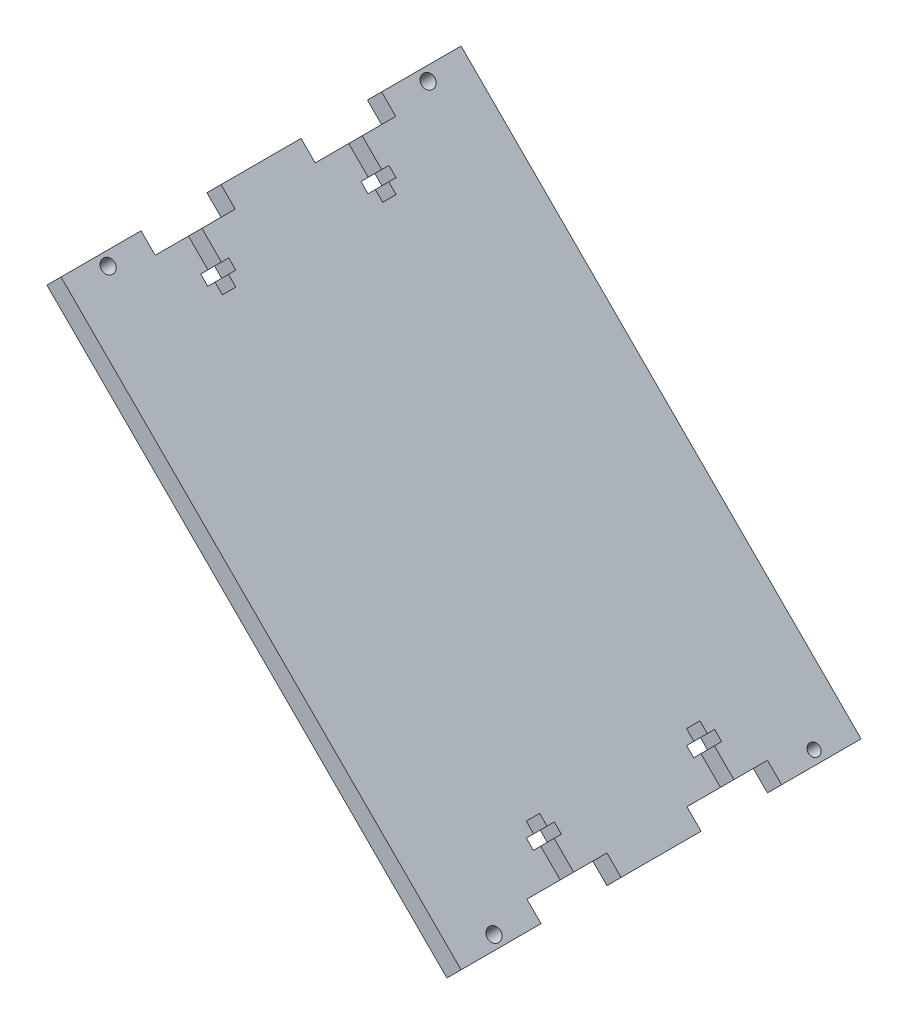
from build123d import *

# Parameters (mm, degrees)
BOSS_EXTRUDE1_DEPTH = 127
SKETCH2_W           = 25.4
SKETCH2_H           = 6.35
SKETCH2_W_2         = 25.559422118
CUT_EXTRUDE1_DEPTH  = 6.35
CUT_EXTRUDE2_DEPTH  = 6.35
SKETCH4_R           = 2.0955
SKETCH4_R_2         = 1.828321723
CUT_EXTRUDE3_DEPTH  = 6.35


with BuildPart() as part:
    # Sketch1 → Boss-Extrude1 (new body)
    with BuildSketch(Plane.XY):
        Polygon((-127, 0), (0, -127), (4.490128061, -122.509871939), (-122.509871939, 4.490128061), align=None)
    extrude(amount=BOSS_EXTRUDE1_DEPTH)

    # Sketch2 → Cut-Extrude1 (cut)
    with BuildSketch(Plane(origin=(-63.5, -63.5, 0), x_dir=(0, 0, 1), z_dir=(-0.7071067811865509, -0.7071067811865441, 0))):
        with Locations((88.9, 86.627561211)):
            Rectangle(SKETCH2_W, SKETCH2_H)
        with Locations((38.020288941, 86.627561211)):
            Rectangle(SKETCH2_W_2, SKETCH2_H)
        with Locations((88.9, -86.627561211)):
            Rectangle(SKETCH2_W, SKETCH2_H)
        with Locations((38.020288941, -86.627561211)):
            Rectangle(SKETCH2_W_2, SKETCH2_H)
    extrude(amount=-CUT_EXTRUDE1_DEPTH, mode=Mode.SUBTRACT)

    # Sketch3 → Cut-Extrude2 (cut)
    with BuildSketch(Plane(origin=(-63.5, -63.5, 0), x_dir=(0, 0, 1), z_dir=(-0.7071067811865509, -0.7071067811865441, 0))):
        Polygon((91.0336, 83.452561211), (86.7664, 83.452561211), (86.7664, 74.689561211), (84.455, 74.689561211), (84.455, 71.514561211), (86.7664, 71.514561211), (86.7664, 68.212561211), (91.0336, 68.212561211), (91.0336, 71.514561211), (93.345, 71.514561211), (93.345, 74.689561211), (91.0336, 74.689561211), align=None)
        Polygon((40.153888941, 83.452561211), (35.886688941, 83.452561211), (35.886688941, 74.689561211), (33.575288941, 74.689561211), (33.575288941, 71.514561211), (35.886688941, 71.514561211), (35.886688941, 68.212561211), (40.153888941, 68.212561211), (40.153888941, 71.514561211), (42.465288941, 71.514561211), (42.465288941, 74.689561211), (40.153888941, 74.689561211), align=None)
        Polygon((86.7664, -83.452561211), (91.0336, -83.452561211), (91.0336, -74.689561211), (93.345, -74.689561211), (93.345, -71.514561211), (91.0336, -71.514561211), (91.0336, -68.212561211), (86.7664, -68.212561211), (86.7664, -71.514561211), (84.455, -71.514561211), (84.455, -74.689561211), (86.7664, -74.689561211), align=None)
        Polygon((35.886688941, -83.452561211), (40.153888941, -83.452561211), (40.153888941, -74.689561211), (42.465288941, -74.689561211), (42.465288941, -71.514561211), (40.153888941, -71.514561211), (40.153888941, -68.212561211), (35.886688941, -68.212561211), (35.886688941, -71.514561211), (33.575288941, -71.514561211), (33.575288941, -74.689561211), (35.886688941, -74.689561211), align=None)
    extrude(amount=-CUT_EXTRUDE2_DEPTH, mode=Mode.SUBTRACT)

    # Sketch4 → Cut-Extrude3 (cut)
    with BuildSketch(Plane(origin=(-59.009871939, -59.009871939, 0), x_dir=(0, 0, -1), z_dir=(0.707106781186551, 0.7071067811865441, 0))):
        with Locations(Location((-114.3, 86.627561211, 0), (0, 0, 90))):
            Circle(SKETCH4_R)
        with Locations(Location((-12.7, 86.627561211, 0), (0, 0, 90))):
            Circle(SKETCH4_R)
        with Locations(Location((-12.7, -86.627561211, 0), (0, 0, 90))):
            Circle(SKETCH4_R_2)
        with Locations(Location((-114.3, -86.627561211, 0), (0, 0, 90))):
            Circle(SKETCH4_R)
    extrude(amount=-CUT_EXTRUDE3_DEPTH, mode=Mode.SUBTRACT)


solid = part.part
